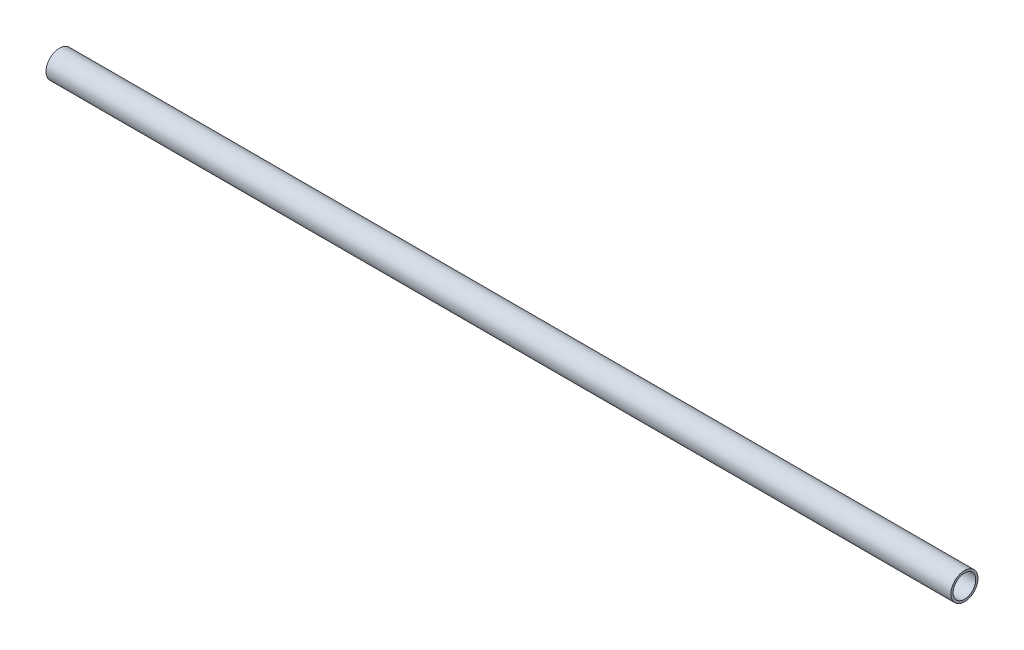
from build123d import *

# Parameters (mm, degrees)
SKETCH1_W = 400
SKETCH1_H = 1


with BuildPart() as part:
    # Sketch1 → Revolve1 (revolve)
    with BuildSketch(Plane.XY, mode=Mode.PRIVATE) as revolve1_sk:
        with Locations((100, 5.5)):
            Rectangle(SKETCH1_W, SKETCH1_H)
    revolve(revolve1_sk.sketch.rotate(Axis((-74.148576038, 0, 0), (1, 0, 0)), 90), axis=Axis((-74.148576038, 0, 0), (1, 0, 0)))


solid = part.part
